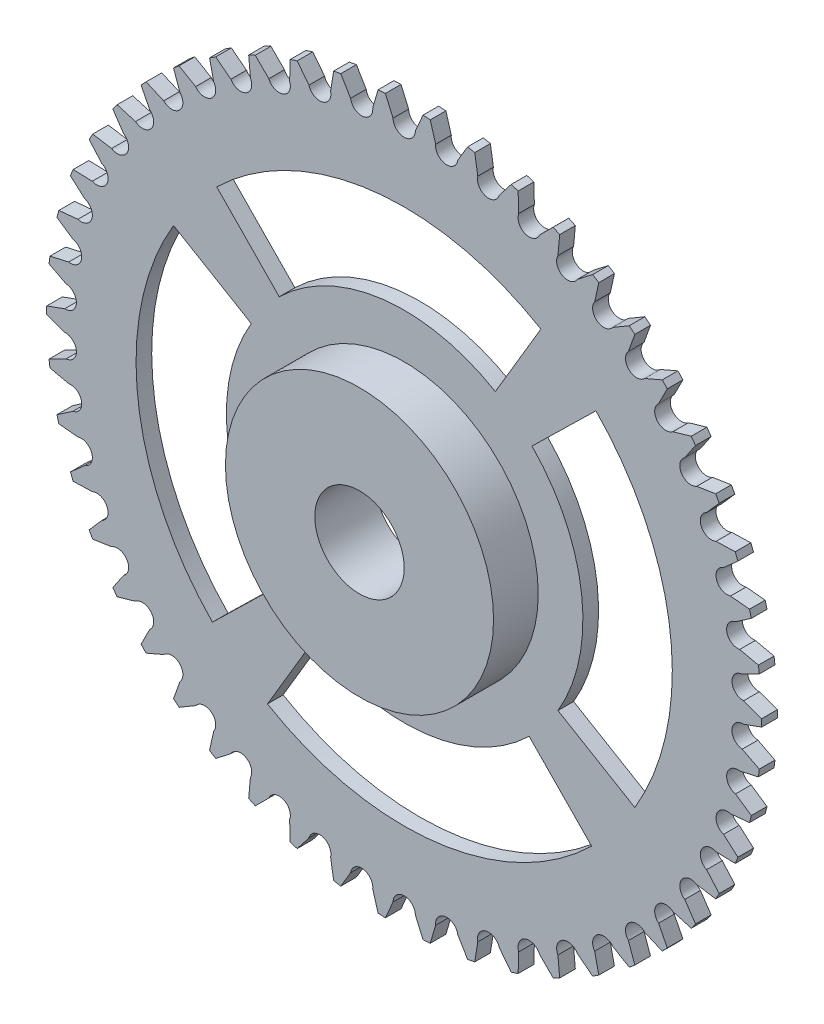
from build123d import *

# Parameters (mm, degrees)
SKETCH1_R           = 80
BOSS_EXTRUDE1_DEPTH = 3.5
SKETCH2_R           = 10
CUT_EXTRUDE1_DEPTH  = 3.5
BOSS_EXTRUDE2_START = 10
SKETCH3_R           = 30
SKETCH3_R_2         = 10
BOSS_EXTRUDE2_DEPTH = 10
CUT_EXTRUDE2_DEPTH  = 10
CUT_EXTRUDE4_DEPTH  = 10
CIRPATTERN2_COUNT   = 50


with BuildPart() as part:
    # Sketch1 → Boss-Extrude1 (new body)
    with BuildSketch(Plane.XY):
        Circle(SKETCH1_R)
    extrude(amount=BOSS_EXTRUDE1_DEPTH)

    # Sketch2 → Cut-Extrude1 (cut)
    with BuildSketch(Plane.XY.offset(3.5)):
        Circle(SKETCH2_R)
    extrude(amount=-CUT_EXTRUDE1_DEPTH, mode=Mode.SUBTRACT)

    # Sketch3 → Boss-Extrude2 (add)
    with BuildSketch(Plane.XY.offset(3.5).offset(BOSS_EXTRUDE2_START)):
        Circle(SKETCH3_R)
        Circle(SKETCH3_R_2, mode=Mode.SUBTRACT)
    extrude(amount=-BOSS_EXTRUDE2_DEPTH)

    # Sketch6 → Cut-Extrude2 (cut)
    with BuildSketch(Plane.XY.offset(3.5)):
        with BuildLine():
            Line((-42.907945288, -41.939339899), (-28.452518283, -27.810515875))
            ThreePointArc((-28.452518283, -27.810515875), (-39.502881982, -4.742668551), (-34.226844973, 20.285306827))
            Line((-34.226844973, 20.285306827), (-51.615684972, 30.591192602))
            ThreePointArc((-51.615684972, 30.591192602), (-59.572214208, -7.152013309), (-42.907945288, -41.939339899))
        make_face()
        with BuildLine():
            Line((30.591192602, 51.615684972), (20.394128401, 34.410456648))
            ThreePointArc((20.394128401, 34.410456648), (-4.768008872, 39.714809472), (-27.959559932, 28.605296859))
            Line((-27.959559932, 28.605296859), (-41.939339899, 42.907945288))
            ThreePointArc((-41.939339899, 42.907945288), (-7.152013309, 59.572214208), (30.591192602, 51.615684972))
        make_face()
        with BuildLine():
            Line((42.907945288, 41.939339899), (28.605296859, 27.959559932))
            ThreePointArc((28.605296859, 27.959559932), (39.714809472, 4.768008872), (34.410456648, -20.394128401))
            Line((34.410456648, -20.394128401), (51.615684972, -30.591192602))
            ThreePointArc((51.615684972, -30.591192602), (59.572214208, 7.152013309), (42.907945288, 41.939339899))
        make_face()
        with BuildLine():
            Line((41.939339899, -42.907945288), (27.959559932, -28.605296859))
            ThreePointArc((27.959559932, -28.605296859), (4.768008872, -39.714809472), (-20.394128401, -34.410456648))
            Line((-20.394128401, -34.410456648), (-30.591192602, -51.615684972))
            ThreePointArc((-30.591192602, -51.615684972), (7.152013309, -59.572214208), (41.939339899, -42.907945288))
        make_face()
    extrude(amount=-CUT_EXTRUDE2_DEPTH, mode=Mode.SUBTRACT)

    # Sketch8 → Cut-Extrude4 (cut)
    with BuildSketch(Plane.XY.offset(3.5)):
        with BuildLine():
            Line((-2.499661832, 75.958881579), (-4.2086217, 79.889220195))
            ThreePointArc((-4.2086217, 79.889220195), (0, 80.158178049), (4.2086217, 79.889220195))
            Line((4.2086217, 79.889220195), (2.499661832, 75.958881579))
            ThreePointArc((2.499661832, 75.958881579), (0, 73.5), (-2.499661832, 75.958881579))
        make_face()
    cut_extrude4 = extrude(amount=-CUT_EXTRUDE4_DEPTH, mode=Mode.SUBTRACT)

    # CirPattern2: Cut-Extrude4 ×50 about axis
    cirpattern2_axis = Axis((0, 0, 0), (0, 0, 1))
    for i in range(1, CIRPATTERN2_COUNT):
        add(cut_extrude4.rotate(cirpattern2_axis, i * 360 / CIRPATTERN2_COUNT), mode=Mode.SUBTRACT)


solid = part.part
